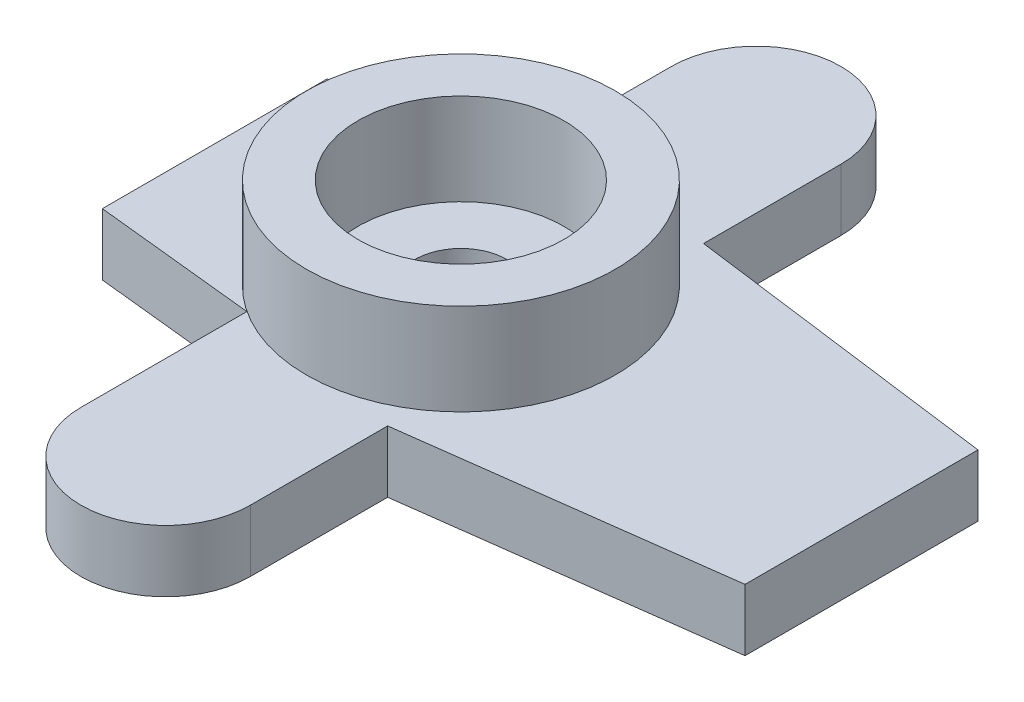
from build123d import *

# Parameters (mm, degrees)
ESTRUSIONE_ESTRUSIONE1_DEPTH = 1.35
SCHIZZO2_R                   = 3.375
ESTRUSIONE_ESTRUSIONE2_DEPTH = 2
SCHIZZO3_R                   = 2.25
TAGLIO_ESTRUSIONE1_DEPTH     = 2
SCHIZZO4_R                   = 1
TAGLIO_ESTRUSIONE2_DEPTH     = 13.225076687


with BuildPart() as part:
    # Schizzo1 → Estrusione-Estrusione1 (new body)
    with BuildSketch(Plane(origin=(0, 0, 0), x_dir=(1, 0, 0), z_dir=(0, 1, 0))):
        with BuildLine():
            ThreePointArc((1.85, 6.45), (0, 8.3), (-1.85, 6.45))
            Line((-1.85, 6.45), (-1.85, 2.824645909))
            Line((-1.85, 2.824645909), (-5.375, 2.455525211))
            Line((-5.375, 2.455525211), (-5.375, -2.455525211))
            Line((-5.375, -2.455525211), (-1.85, -2.824645909))
            Line((-1.85, -2.824645909), (-1.85, -6.45))
            ThreePointArc((-1.85, -6.45), (0, -8.3), (1.85, -6.45))
            Line((1.85, -6.45), (1.85, -3.45))
            Line((1.85, -3.45), (8.75, -2.543939394))
            Line((8.75, -2.543939394), (8.75, 2.543939394))
            Line((8.75, 2.543939394), (1.85, 3.45))
            Line((1.85, 3.45), (1.85, 6.45))
        make_face()
    extrude(amount=ESTRUSIONE_ESTRUSIONE1_DEPTH)

    # Schizzo2 → Estrusione-Estrusione2 (add)
    with BuildSketch(Plane(origin=(0, 1.35, 0), x_dir=(1, 0, 0), z_dir=(0, 1, 0))):
        with Locations(Location((0, 0, 0), (0, 0, 270))):
            Circle(SCHIZZO2_R)
    extrude(amount=ESTRUSIONE_ESTRUSIONE2_DEPTH)

    # Schizzo3 → Taglio-Estrusione1 (cut)
    with BuildSketch(Plane(origin=(0, 3.35, 0), x_dir=(1, 0, 0), z_dir=(0, 1, 0))):
        with Locations(Location((0, 0, 0), (0, 0, 270))):
            Circle(SCHIZZO3_R)
    extrude(amount=-TAGLIO_ESTRUSIONE1_DEPTH, mode=Mode.SUBTRACT)

    # Schizzo4 → Taglio-Estrusione2 (cut, through all)
    with BuildSketch(Plane(origin=(0, 1.35, 0), x_dir=(1, 0, 0), z_dir=(0, 1, 0))):
        with Locations(Location((0, 0, 0), (0, 0, 270))):
            Circle(SCHIZZO4_R)
    extrude(amount=-TAGLIO_ESTRUSIONE2_DEPTH, mode=Mode.SUBTRACT)


solid = part.part
